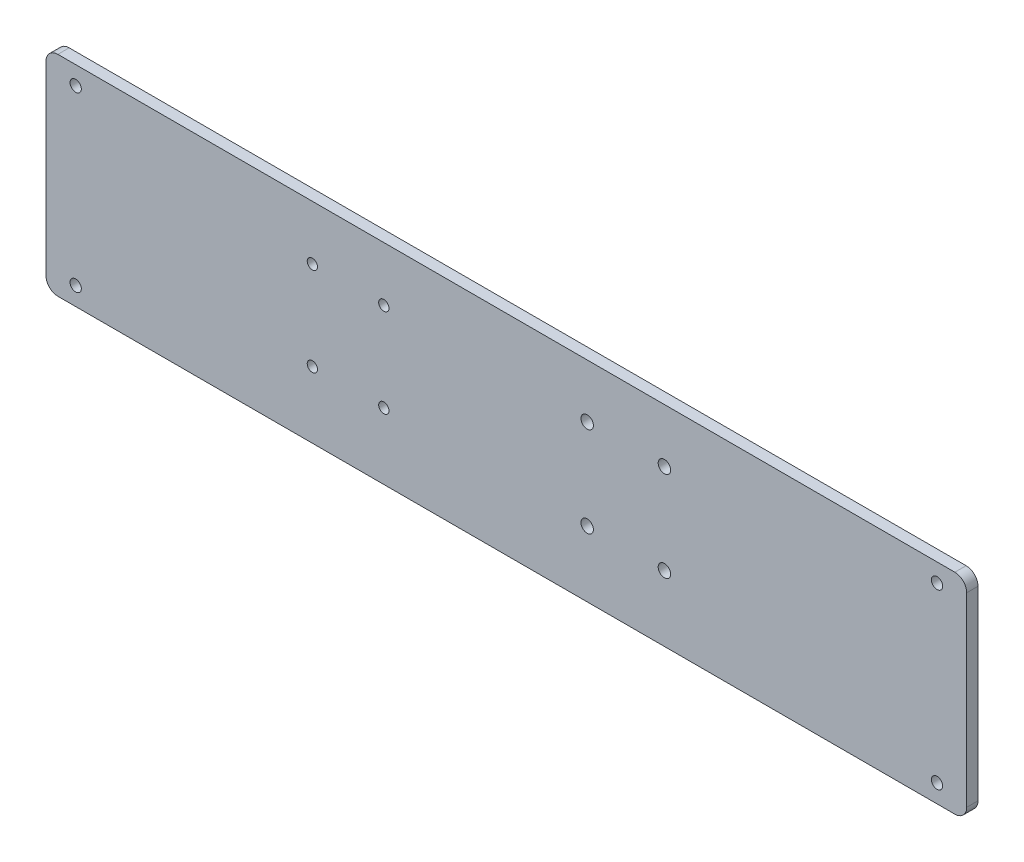
from build123d import *

# Parameters (mm, degrees)
SKETCH1_R           = 2.1
SKETCH1_R_2         = 1.9
SKETCH1_R_3         = 1.73
BOSS_EXTRUDE1_DEPTH = 3.8


with BuildPart() as part:
    # Sketch1 → Boss-Extrude1 (new body)
    with BuildSketch(Plane.XY):
        with BuildLine():
            Line((-10, -150.468857407), (-10, -87.916121505))
            ThreePointArc((-10, -87.916121505), (-8.828427125, -85.08769438), (-6, -83.916121505))
            Line((-6, -83.916121505), (296, -83.916121505))
            ThreePointArc((296, -83.916121505), (298.828427125, -85.08769438), (300, -87.916121505))
            Line((300, -87.916121505), (300, -150.468857407))
            ThreePointArc((300, -150.468857407), (298.828427125, -153.297284532), (296, -154.468857407))
            Line((296, -154.468857407), (-6, -154.468857407))
            ThreePointArc((-6, -154.468857407), (-8.828427125, -153.297284532), (-10, -150.468857407))
        make_face()
        with Locations(Location((172.212346295, -102, 0), (0, 0, 180))):
            Circle(SKETCH1_R, mode=Mode.SUBTRACT)
        with Locations(Location((290.004037955, -90.075164194, 0), (0, 0, 180))):
            Circle(SKETCH1_R_2, mode=Mode.SUBTRACT)
        with Locations(Location((290.004037955, -148.309814719, 0), (0, 0, 180))):
            Circle(SKETCH1_R_2, mode=Mode.SUBTRACT)
        with Locations(Location((-0.004037955, -148.309814719, 0), (0, 0, 180))):
            Circle(SKETCH1_R_2, mode=Mode.SUBTRACT)
        with Locations(Location((-0.004037955, -90.075164194, 0), (0, 0, 180))):
            Circle(SKETCH1_R_2, mode=Mode.SUBTRACT)
        with Locations(Location((198.212346295, -102, 0), (0, 0, 180))):
            Circle(SKETCH1_R, mode=Mode.SUBTRACT)
        with Locations(Location((172.212346295, -132.35, 0), (0, 0, 180))):
            Circle(SKETCH1_R, mode=Mode.SUBTRACT)
        with Locations(Location((198.212346295, -132.35, 0), (0, 0, 180))):
            Circle(SKETCH1_R, mode=Mode.SUBTRACT)
        with Locations(Location((79.683867595, -132.12, 0), (0, 0, 180))):
            Circle(SKETCH1_R_3, mode=Mode.SUBTRACT)
        with Locations(Location((79.683867595, -102.23, 0), (0, 0, 180))):
            Circle(SKETCH1_R_3, mode=Mode.SUBTRACT)
        with Locations(Location((103.743867595, -102.23, 0), (0, 0, 180))):
            Circle(SKETCH1_R_3, mode=Mode.SUBTRACT)
        with Locations(Location((103.743867595, -132.12, 0), (0, 0, 180))):
            Circle(SKETCH1_R_3, mode=Mode.SUBTRACT)
    extrude(amount=BOSS_EXTRUDE1_DEPTH)


solid = part.part
